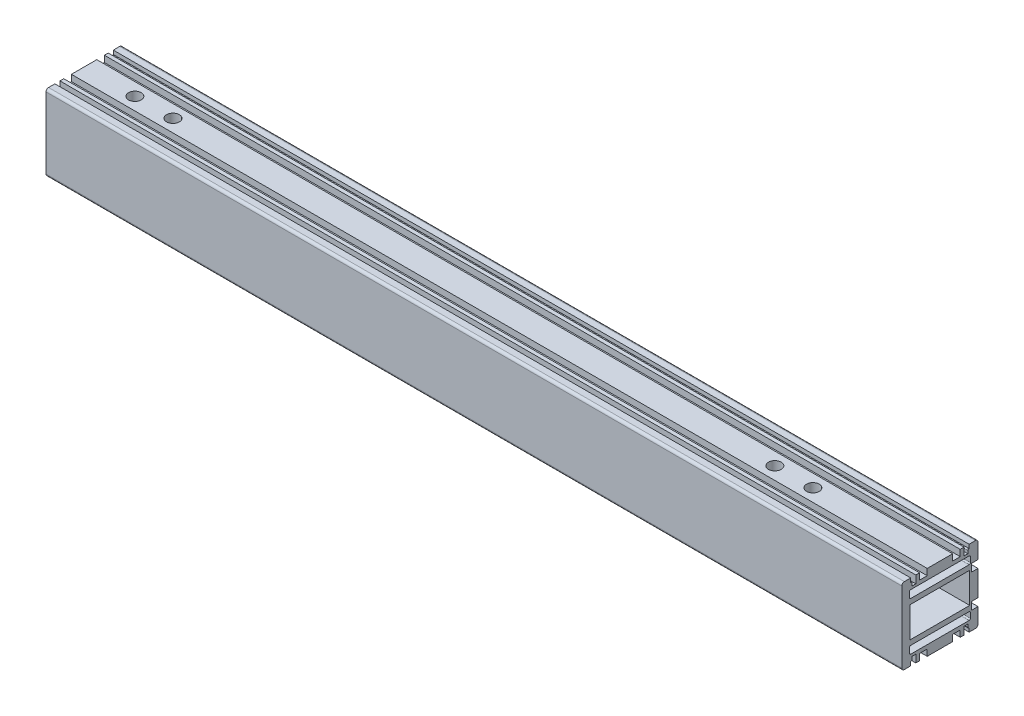
from build123d import *

# Parameters (mm, degrees)
SKETCH_1_W             = 23.5
SKETCH_1_H             = 12
EXTRUDE_1_DEPTH        = 168.5
HOLE_WIZARD_M6_1_D     = 5
HOLE_WIZARD_M6_1_DEPTH = 15
HOLE_WIZARD_M6_1_TIP   = 1.502151548


with BuildPart() as part:
    # 草图1 → 凸台-拉伸1 (new, symmetric)
    with BuildSketch(Plane(origin=(0, 0, 0), x_dir=(0, 0, -1), z_dir=(1, 0, 0))):
        with BuildLine():
            Line((-14, 15), (-11.5, 15))
            Line((-11.5, 15), (-11.5, 13.5))
            Line((-11.5, 13.5), (-11.4, 13.5))
            ThreePointArc((-11.4, 13.5), (-11.117157288, 13.382842712), (-11, 13.1))
            Line((-11, 13.1), (-11, 12))
            Line((-11, 12), (-9.5, 12))
            Line((-9.5, 12), (-9.5, 15))
            Line((-9.5, 15), (-8, 15))
            Line((-8, 15), (-8, 12.5))
            Line((-8, 12.5), (-5, 12.5))
            Line((-5, 12.5), (-5, 15))
            Line((-5, 15), (5, 15))
            Line((5, 15), (5, 12.5))
            Line((5, 12.5), (8, 12.5))
            Line((8, 12.5), (8, 15))
            Line((8, 15), (9.5, 15))
            Line((9.5, 15), (9.5, 12))
            Line((9.5, 12), (11, 12))
            Line((11, 12), (11, 13.1))
            ThreePointArc((11, 13.1), (11.117157288, 13.382842712), (11.4, 13.5))
            Line((11.4, 13.5), (11.5, 13.5))
            Line((11.5, 13.5), (11.5, 15))
            Line((11.5, 15), (14, 15))
            ThreePointArc((14, 15), (14.707106781, 14.707106781), (15, 14))
            Line((15, 14), (15, 8))
            Line((15, 8), (12.5, 8))
            Line((12.5, 8), (12.5, 5))
            Line((12.5, 5), (15, 5))
            Line((15, 5), (15, -5))
            Line((15, -5), (12.5, -5))
            Line((12.5, -5), (12.5, -8))
            Line((12.5, -8), (15, -8))
            Line((15, -8), (15, -14))
            ThreePointArc((15, -14), (14.707106781, -14.707106781), (14, -15))
            Line((14, -15), (11.5, -15))
            Line((11.5, -15), (11.5, -13.5))
            Line((11.5, -13.5), (11.4, -13.5))
            ThreePointArc((11.4, -13.5), (11.117157288, -13.382842712), (11, -13.1))
            Line((11, -13.1), (11, -12))
            Line((11, -12), (9.5, -12))
            Line((9.5, -12), (9.5, -15))
            Line((9.5, -15), (8, -15))
            Line((8, -15), (8, -12.5))
            Line((8, -12.5), (5, -12.5))
            Line((5, -12.5), (5, -15))
            Line((5, -15), (-5, -15))
            Line((-5, -15), (-5, -12.5))
            Line((-5, -12.5), (-8, -12.5))
            Line((-8, -12.5), (-8, -15))
            Line((-8, -15), (-9.5, -15))
            Line((-9.5, -15), (-9.5, -12))
            Line((-9.5, -12), (-11, -12))
            Line((-11, -12), (-11, -13.1))
            ThreePointArc((-11, -13.1), (-11.117157288, -13.382842712), (-11.4, -13.5))
            Line((-11.4, -13.5), (-11.5, -13.5))
            Line((-11.5, -13.5), (-11.5, -15))
            Line((-11.5, -15), (-14, -15))
            ThreePointArc((-14, -15), (-14.707106781, -14.707106781), (-15, -14))
            Line((-15, -14), (-15, 14))
            ThreePointArc((-15, 14), (-14.707106781, 14.707106781), (-14, 15))
        make_face()
        with BuildLine():
            Line((12, -10.5), (12, -8.5))
            ThreePointArc((12, -8.5), (11.853553391, -8.146446609), (11.5, -8))
            Line((11.5, -8), (-11.5, -8))
            ThreePointArc((-11.5, -8), (-11.853553391, -8.146446609), (-12, -8.5))
            Line((-12, -8.5), (-12, -10.5))
            ThreePointArc((-12, -10.5), (-11.853553391, -10.853553391), (-11.5, -11))
            Line((-11.5, -11), (11.5, -11))
            ThreePointArc((11.5, -11), (11.853553391, -10.853553391), (12, -10.5))
        make_face(mode=Mode.SUBTRACT)
        with BuildLine():
            Line((-11.5, 11), (11.5, 11))
            ThreePointArc((11.5, 11), (11.853553391, 10.853553391), (12, 10.5))
            Line((12, 10.5), (12, 8.5))
            ThreePointArc((12, 8.5), (11.853553391, 8.146446609), (11.5, 8))
            Line((11.5, 8), (-11.5, 8))
            ThreePointArc((-11.5, 8), (-11.853553391, 8.146446609), (-12, 8.5))
            Line((-12, 8.5), (-12, 10.5))
            ThreePointArc((-12, 10.5), (-11.853553391, 10.853553391), (-11.5, 11))
        make_face(mode=Mode.SUBTRACT)
        Rectangle(SKETCH_1_W, SKETCH_1_H, mode=Mode.SUBTRACT)
    extrude(amount=EXTRUDE_1_DEPTH, both=True)

    # M6 螺纹孔1
    with Locations(Plane(origin=(0, 15, 0), x_dir=(-1, 0, 0), z_dir=(0, 1, 0))):
        with Locations((148.5, 0), (133.5, 0), (-103.5, 0), (-118.5, 0)):
            Hole(HOLE_WIZARD_M6_1_D / 2, depth=HOLE_WIZARD_M6_1_DEPTH)
            with Locations((0, 0, -(HOLE_WIZARD_M6_1_DEPTH + HOLE_WIZARD_M6_1_TIP / 2))):  # 118° drill point
                Cone(0, HOLE_WIZARD_M6_1_D / 2, HOLE_WIZARD_M6_1_TIP, mode=Mode.SUBTRACT)


solid = part.part
